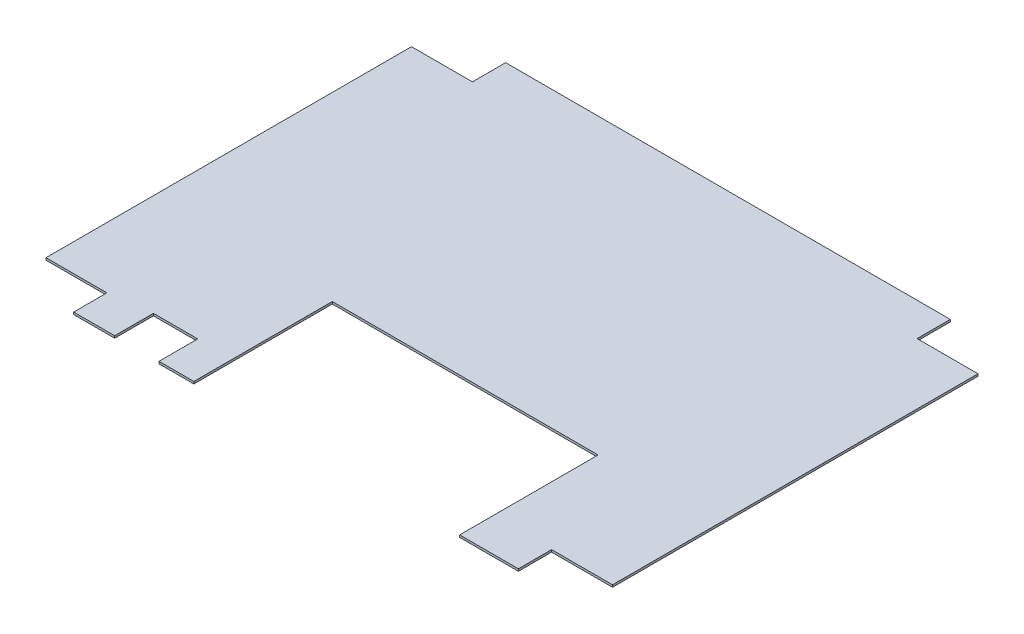
from build123d import *

# Parameters (mm, degrees)
CROQUIS1_W              = 511.5
CROQUIS1_H              = 390
SALIENTE_EXTRUIR1_DEPTH = 2
CROQUIS3_W              = 55
CROQUIS3_H              = 30
CORTAR_EXTRUIR1_DEPTH   = 2
CROQUIS4_W              = 240
CROQUIS4_H              = 125
CORTAR_EXTRUIR2_DEPTH   = 2
CROQUIS5_W              = 40
CROQUIS5_H              = 35
CORTAR_EXTRUIR3_DEPTH   = 2


with BuildPart() as part:
    # Croquis1 → Saliente-Extruir1 (new body)
    with BuildSketch(Plane(origin=(0, 0, 0), x_dir=(1, 0, 0), z_dir=(0, 1, 0))):
        with Locations((255.75, 195)):
            Rectangle(CROQUIS1_W, CROQUIS1_H)
    extrude(amount=SALIENTE_EXTRUIR1_DEPTH)

    # Croquis3 → Cortar-Extruir1 (cut)
    with BuildSketch(Plane(origin=(0, 2, 0), x_dir=(1, 0, 0), z_dir=(0, 1, 0))):
        with Locations((484, 15)):
            Rectangle(CROQUIS3_W, CROQUIS3_H)
        with Locations((27.5, 15)):
            Rectangle(CROQUIS3_W, CROQUIS3_H)
        with Locations((484, 375)):
            Rectangle(CROQUIS3_W, CROQUIS3_H)
        with Locations((27.5, 375)):
            Rectangle(CROQUIS3_W, CROQUIS3_H)
    extrude(amount=-CORTAR_EXTRUIR1_DEPTH, mode=Mode.SUBTRACT)

    # Croquis4 → Cortar-Extruir2 (cut)
    with BuildSketch(Plane(origin=(0, 2, 0), x_dir=(1, 0, 0), z_dir=(0, 1, 0))):
        with Locations((283.5, 62.5)):
            Rectangle(CROQUIS4_W, CROQUIS4_H)
    extrude(amount=-CORTAR_EXTRUIR2_DEPTH, mode=Mode.SUBTRACT)

    # Croquis5 → Cortar-Extruir3 (cut)
    with BuildSketch(Plane(origin=(0, 2, 0), x_dir=(1, 0, 0), z_dir=(0, 1, 0))):
        with Locations((112, 17.5)):
            Rectangle(CROQUIS5_W, CROQUIS5_H)
    extrude(amount=-CORTAR_EXTRUIR3_DEPTH, mode=Mode.SUBTRACT)


solid = part.part
